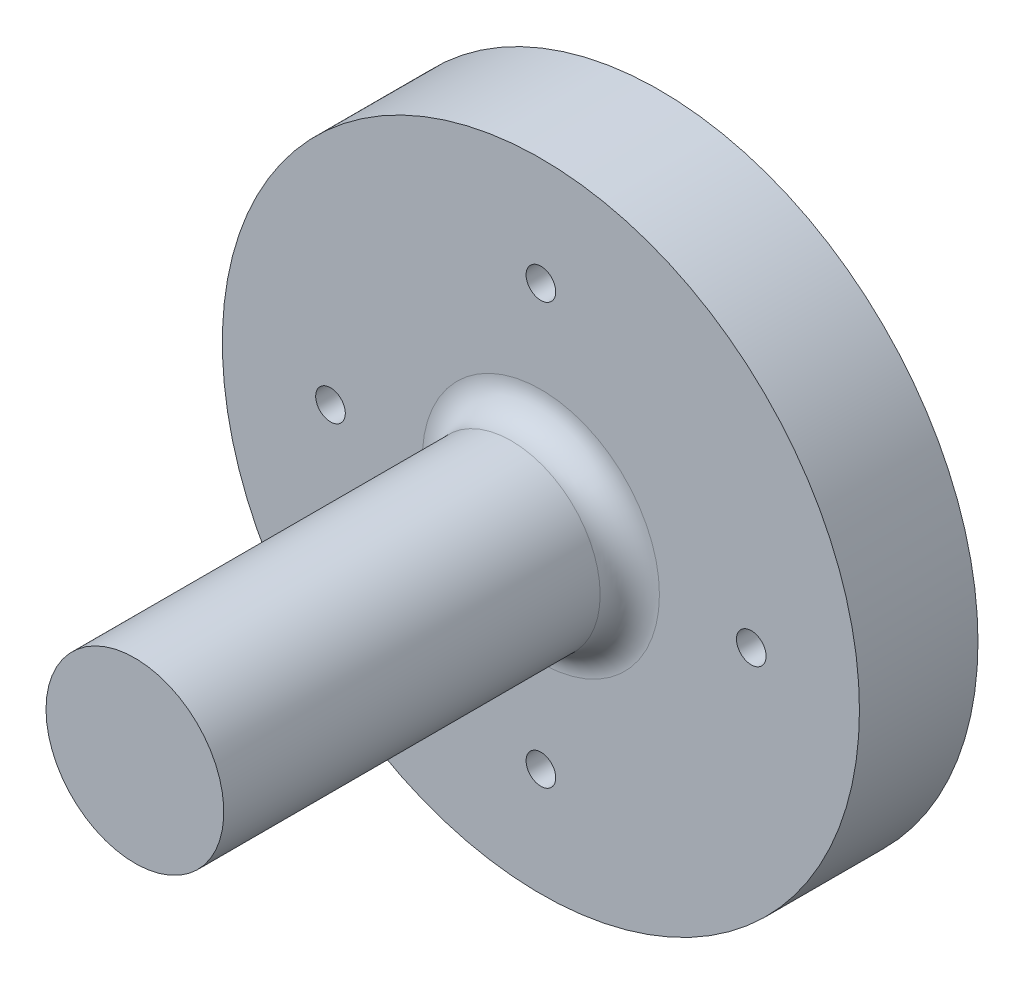
from build123d import *

# Parameters (mm, degrees)
ESBO_O1_R                = 10.75
RESSALTO_EXTRUS_O1_DEPTH = 4
ESBO_O2_R                = 3
RESSALTO_EXTRUS_O2_DEPTH = 13.7
FILETE2_R                = 1
ESBO_O3_R                = 0.5
CORTE_EXTRUS_O1_DEPTH    = 21.464970071


with BuildPart() as part:
    # Esboço1 → Ressalto-extrusão1 (new body)
    with BuildSketch(Plane.XY):
        Circle(ESBO_O1_R)
    extrude(amount=RESSALTO_EXTRUS_O1_DEPTH)

    # Esboço2 → Ressalto-extrusão2 (add)
    with BuildSketch(Plane.XY.offset(4)):
        with Locations(Location((0, 0, 0), (0, 0, 180))):
            Circle(ESBO_O2_R)
    extrude(amount=RESSALTO_EXTRUS_O2_DEPTH)

    # Filete2
    filete2_edges = [part.edges().sort_by_distance(p)[0] for p in [
        (3, 0, 4),
    ]]
    fillet(filete2_edges, radius=FILETE2_R)

    # Esboço3 → Corte-extrusão1 (cut, through all)
    with BuildSketch(Plane.XY.offset(4)):
        with Locations((7.1, 0)):
            Circle(ESBO_O3_R)
        with Locations((-7.1, 0)):
            Circle(ESBO_O3_R)
        with Locations((0, 7.1)):
            Circle(ESBO_O3_R)
        with Locations((0, -7.1)):
            Circle(ESBO_O3_R)
    extrude(amount=-CORTE_EXTRUS_O1_DEPTH, mode=Mode.SUBTRACT)


solid = part.part
